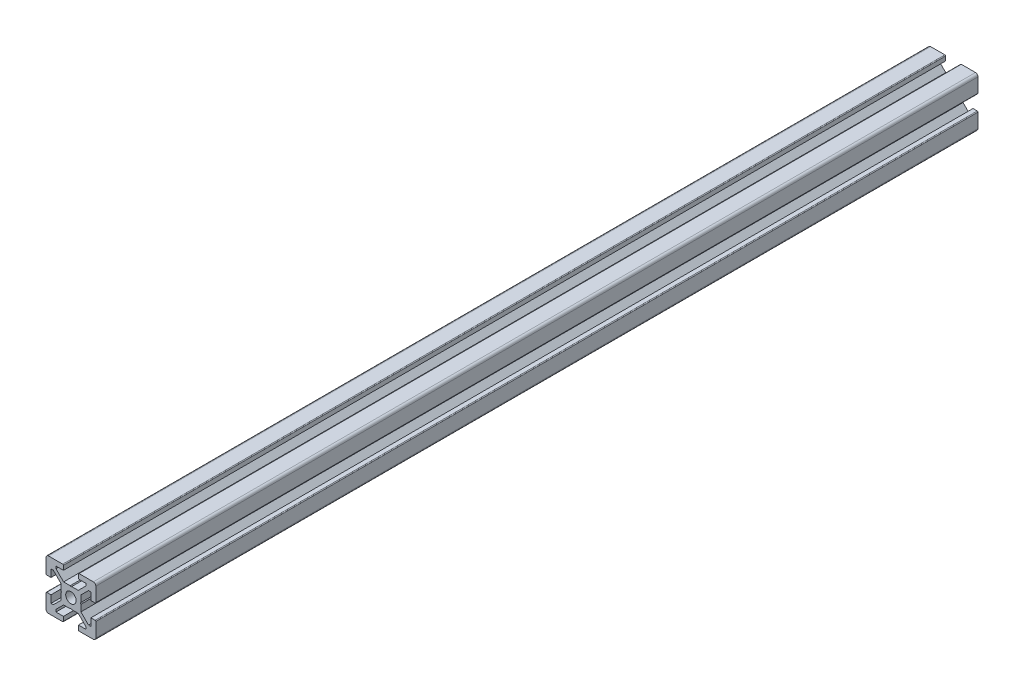
from build123d import *

# Parameters (mm, degrees)
SKETCH1_R           = 2.1
BOSS_EXTRUDE1_DEPTH = 177.025


with BuildPart() as part:
    # Sketch1 → Boss-Extrude1 (new, symmetric)
    with BuildSketch(Plane(origin=(0, 0, 0), x_dir=(-1, 0, 0), z_dir=(0, 0, -1))):
        with BuildLine():
            Line((10, 3.3), (10, 9))
            ThreePointArc((10, 9), (9.707106781, 9.707106781), (9, 10))
            Line((9, 10), (3.3, 10))
            ThreePointArc((3.3, 10), (3.087867966, 9.912132034), (3, 9.7))
            Line((3, 9.7), (3, 8))
            Line((3, 8), (6, 8))
            Line((6, 8), (6, 7.060660172))
            Line((6, 7.060660172), (2.939339828, 4))
            Line((2.939339828, 4), (0.3, 4))
            Line((0.3, 4), (0, 3.7))
            Line((0, 3.7), (-0.3, 4))
            Line((-0.3, 4), (-2.939339828, 4))
            Line((-2.939339828, 4), (-6, 7.060660172))
            Line((-6, 7.060660172), (-6, 8))
            Line((-6, 8), (-3, 8))
            Line((-3, 8), (-3, 9.7))
            ThreePointArc((-3, 9.7), (-3.087867966, 9.912132034), (-3.3, 10))
            Line((-3.3, 10), (-9, 10))
            ThreePointArc((-9, 10), (-9.707106781, 9.707106781), (-10, 9))
            Line((-10, 9), (-10, 3.3))
            ThreePointArc((-10, 3.3), (-9.912132034, 3.087867966), (-9.7, 3))
            Line((-9.7, 3), (-8, 3))
            Line((-8, 3), (-8, 6))
            Line((-8, 6), (-7.060660172, 6))
            Line((-7.060660172, 6), (-4, 2.939339828))
            Line((-4, 2.939339828), (-4, 0.3))
            Line((-4, 0.3), (-3.7, 0))
            Line((-3.7, 0), (-4, -0.3))
            Line((-4, -0.3), (-4, -2.939339828))
            Line((-4, -2.939339828), (-7.060660172, -6))
            Line((-7.060660172, -6), (-8, -6))
            Line((-8, -6), (-8, -3))
            Line((-8, -3), (-9.7, -3))
            ThreePointArc((-9.7, -3), (-9.912132034, -3.087867966), (-10, -3.3))
            Line((-10, -3.3), (-10, -9))
            ThreePointArc((-10, -9), (-9.707106781, -9.707106781), (-9, -10))
            Line((-9, -10), (-3.3, -10))
            ThreePointArc((-3.3, -10), (-3.087867966, -9.912132034), (-3, -9.7))
            Line((-3, -9.7), (-3, -8))
            Line((-3, -8), (-6, -8))
            Line((-6, -8), (-6, -7.060660172))
            Line((-6, -7.060660172), (-2.939339828, -4))
            Line((-2.939339828, -4), (-0.3, -4))
            Line((-0.3, -4), (0, -3.7))
            Line((0, -3.7), (0.3, -4))
            Line((0.3, -4), (2.939339828, -4))
            Line((2.939339828, -4), (6, -7.060660172))
            Line((6, -7.060660172), (6, -8))
            Line((6, -8), (3, -8))
            Line((3, -8), (3, -9.7))
            ThreePointArc((3, -9.7), (3.087867966, -9.912132034), (3.3, -10))
            Line((3.3, -10), (9, -10))
            ThreePointArc((9, -10), (9.707106781, -9.707106781), (10, -9))
            Line((10, -9), (10, -3.3))
            ThreePointArc((10, -3.3), (9.912132034, -3.087867966), (9.7, -3))
            Line((9.7, -3), (8, -3))
            Line((8, -3), (8, -6))
            Line((8, -6), (7.060660172, -6))
            Line((7.060660172, -6), (4, -2.939339828))
            Line((4, -2.939339828), (4, -0.3))
            Line((4, -0.3), (3.7, 0))
            Line((3.7, 0), (4, 0.3))
            Line((4, 0.3), (4, 2.939339828))
            Line((4, 2.939339828), (7.060660172, 6))
            Line((7.060660172, 6), (8, 6))
            Line((8, 6), (8, 3))
            Line((8, 3), (9.7, 3))
            ThreePointArc((9.7, 3), (9.912132034, 3.087867966), (10, 3.3))
        make_face()
        Circle(SKETCH1_R, mode=Mode.SUBTRACT)
    extrude(amount=BOSS_EXTRUDE1_DEPTH, both=True)


solid = part.part
